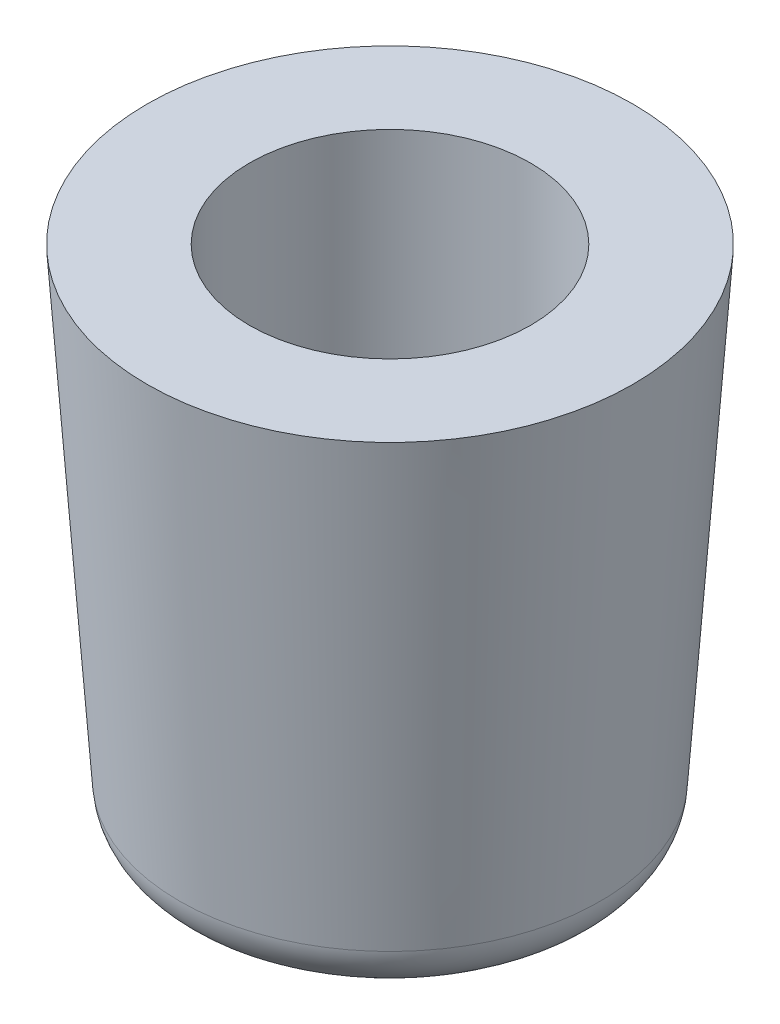
from build123d import *

# Parameters (mm, degrees)
SKETCH1_R           = 4.75
BOSS_EXTRUDE1_DEPTH = 10
BOSS_EXTRUDE1_DRAFT = -4
SKETCH2_R           = 2.75
CUT_EXTRUDE1_DEPTH  = 4
FILLET1_R           = 1


with BuildPart() as part:
    # Sketch1 → Boss-Extrude1 (with draft: the straight prism first)
    with BuildSketch(Plane(origin=(0, 0, 0), x_dir=(1, 0, 0), z_dir=(0, 1, 0))):
        Circle(SKETCH1_R)
    extrude(amount=-BOSS_EXTRUDE1_DEPTH)
    # Boss-Extrude1: the draft: its side faces are tilted about the plane it starts from
    boss_extrude1_sides = [part.faces().sort_by_distance(p)[0] for p in [
        (-4.75, -5, 0),
    ]]
    draft(boss_extrude1_sides, Plane(origin=(0, 0, 0), x_dir=(1, 0, 0), z_dir=(0, 1, 0)), BOSS_EXTRUDE1_DRAFT)

    # Sketch2 → Cut-Extrude1 (cut)
    with BuildSketch(Plane(origin=(0, 0, 0), x_dir=(1, 0, 0), z_dir=(0, 1, 0))):
        with Locations(Location((0, 0, 0), (0, 0, 270))):
            Circle(SKETCH2_R)
    extrude(amount=-CUT_EXTRUDE1_DEPTH, mode=Mode.SUBTRACT)

    # Fillet1
    fillet1_edges = [part.edges().sort_by_distance(p)[0] for p in [
        (-4.050731881, -10, 0),
    ]]
    fillet(fillet1_edges, radius=FILLET1_R)


solid = part.part
